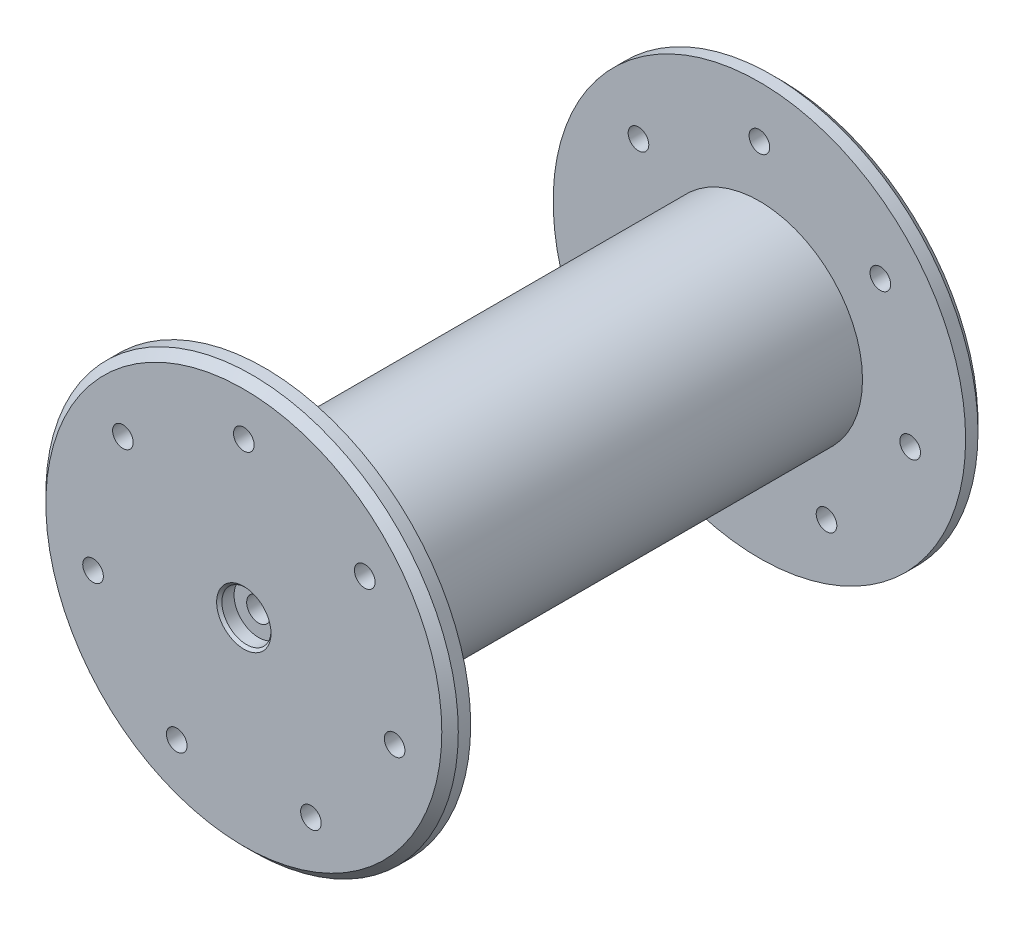
from build123d import *

# Parameters (mm, degrees)
SKETCH2_R                = 25
BOSS_EXTRUDE1_DEPTH      = 60
SKETCH3_R                = 50
BOSS_EXTRUDE2_DEPTH      = 5
CHAMFER1_SIZE            = 2
SKETCH4_R                = 2.5
CUT_EXTRUDE1_DEPTH       = 144.614066163
CIRPATTERN1_COUNT        = 7
MIRROR1_COPY_1_SKETCH_R  = 2.5
MIRROR1_COPY_1_DEPTH     = 144.614066163
MIRROR1_COPY_2_SKETCH_R  = 2.5
MIRROR1_COPY_2_DEPTH     = 144.614066163
MIRROR1_COPY_3_SKETCH_R  = 2.5
MIRROR1_COPY_3_DEPTH     = 144.614066163
MIRROR1_COPY_4_SKETCH_R  = 2.5
MIRROR1_COPY_4_DEPTH     = 144.614066163
MIRROR1_COPY_5_SKETCH_R  = 2.5
MIRROR1_COPY_5_DEPTH     = 144.614066163
MIRROR1_COPY_6_SKETCH_R  = 2.5
MIRROR1_COPY_6_DEPTH     = 144.614066163
CHAMFER1_OF_MIRROR1_SIZE = 2


with BuildPart() as part:
    # Sketch2 → Boss-Extrude1 (new, symmetric)
    with BuildSketch(Plane.XY):
        Circle(SKETCH2_R)
    extrude(amount=BOSS_EXTRUDE1_DEPTH, both=True)

    # Sketch3 → Boss-Extrude2 (add)
    with BuildSketch(Plane.XY.offset(60)):
        Circle(SKETCH3_R)
    boss_extrude2 = extrude(amount=BOSS_EXTRUDE2_DEPTH)

    # Chamfer1
    chamfer1_edges = [part.edges().sort_by_distance(p)[0] for p in [
        (-50, 0, 65),
    ]]
    chamfer(chamfer1_edges, length=CHAMFER1_SIZE)

    # Sketch4 → Cut-Extrude1 (cut, through all)
    with BuildSketch(Plane.XY.offset(65)):
        with Locations((0, 37.5)):
            Circle(SKETCH4_R)
    cut_extrude1 = extrude(amount=-CUT_EXTRUDE1_DEPTH, mode=Mode.SUBTRACT)

    # CirPattern1: Cut-Extrude1 ×7 about axis
    cirpattern1_axis = Axis((0, 0, 0), (0, 0, 1))
    for i in range(1, CIRPATTERN1_COUNT):
        add(cut_extrude1.rotate(cirpattern1_axis, i * 360 / CIRPATTERN1_COUNT), mode=Mode.SUBTRACT)

    # Sketch6 → CBORE for #12 Binding Head Machine Screw1 (revolve, cut)
    with BuildSketch(Plane(origin=(0, 0, 65), x_dir=(0, -1, 0), z_dir=(1, 0, 0))):
        Polygon((0, 0), (0, 130), (2.8956, 130), (2.8956, 3.5814), (5.95376, 3.5814), (5.95376, 0.635), (6.58876, 0), align=None)
    cbore_for_12_binding_head_machine_screw = revolve(axis=Axis((0, 0, 71.35), (0, 0, -1)), mode=Mode.SUBTRACT)

    # Mirror1: Boss-Extrude2, Cut-Extrude1, CBORE for #12 Binding Head Machine Screw1 across plane
    add(boss_extrude2.mirror(Plane.XY))
    add(cut_extrude1.mirror(Plane.XY), mode=Mode.SUBTRACT)
    add(cbore_for_12_binding_head_machine_screw.mirror(Plane.XY), mode=Mode.SUBTRACT)

    # Mirror1 copy 1 sketch → Mirror1 copy 1 (cut, through all)
    with BuildSketch(Plane(origin=(0, 0, -65), x_dir=(0.6234898018587336, 0.7818314824680298, 0), z_dir=(0, 0, -1))):
        with Locations((0, -37.5)):
            Circle(MIRROR1_COPY_1_SKETCH_R)
    extrude(amount=-MIRROR1_COPY_1_DEPTH, mode=Mode.SUBTRACT)

    # Mirror1 copy 2 sketch → Mirror1 copy 2 (cut, through all)
    with BuildSketch(Plane(origin=(0, 0, -65), x_dir=(-0.22252093395631434, 0.9749279121818236, 0), z_dir=(0, 0, -1))):
        with Locations((0, -37.5)):
            Circle(MIRROR1_COPY_2_SKETCH_R)
    extrude(amount=-MIRROR1_COPY_2_DEPTH, mode=Mode.SUBTRACT)

    # Mirror1 copy 3 sketch → Mirror1 copy 3 (cut, through all)
    with BuildSketch(Plane(origin=(0, 0, -65), x_dir=(-0.900968867902419, 0.43388373911755823, 0), z_dir=(0, 0, -1))):
        with Locations((0, -37.5)):
            Circle(MIRROR1_COPY_3_SKETCH_R)
    extrude(amount=-MIRROR1_COPY_3_DEPTH, mode=Mode.SUBTRACT)

    # Mirror1 copy 4 sketch → Mirror1 copy 4 (cut, through all)
    with BuildSketch(Plane(origin=(0, 0, -65), x_dir=(-0.9009688679024191, -0.433883739117558, 0), z_dir=(0, 0, -1))):
        with Locations((0, -37.5)):
            Circle(MIRROR1_COPY_4_SKETCH_R)
    extrude(amount=-MIRROR1_COPY_4_DEPTH, mode=Mode.SUBTRACT)

    # Mirror1 copy 5 sketch → Mirror1 copy 5 (cut, through all)
    with BuildSketch(Plane(origin=(0, 0, -65), x_dir=(-0.2225209339563137, -0.9749279121818237, 0), z_dir=(0, 0, -1))):
        with Locations((0, -37.5)):
            Circle(MIRROR1_COPY_5_SKETCH_R)
    extrude(amount=-MIRROR1_COPY_5_DEPTH, mode=Mode.SUBTRACT)

    # Mirror1 copy 6 sketch → Mirror1 copy 6 (cut, through all)
    with BuildSketch(Plane(origin=(0, 0, -65), x_dir=(0.6234898018587334, -0.7818314824680299, 0), z_dir=(0, 0, -1))):
        with Locations((0, -37.5)):
            Circle(MIRROR1_COPY_6_SKETCH_R)
    extrude(amount=-MIRROR1_COPY_6_DEPTH, mode=Mode.SUBTRACT)

    # Chamfer1 of Mirror1
    chamfer1_of_mirror1_edges = [part.edges().sort_by_distance(p)[0] for p in [
        (-50, 0, -65),
    ]]
    chamfer(chamfer1_of_mirror1_edges, length=CHAMFER1_OF_MIRROR1_SIZE)


solid = part.part
